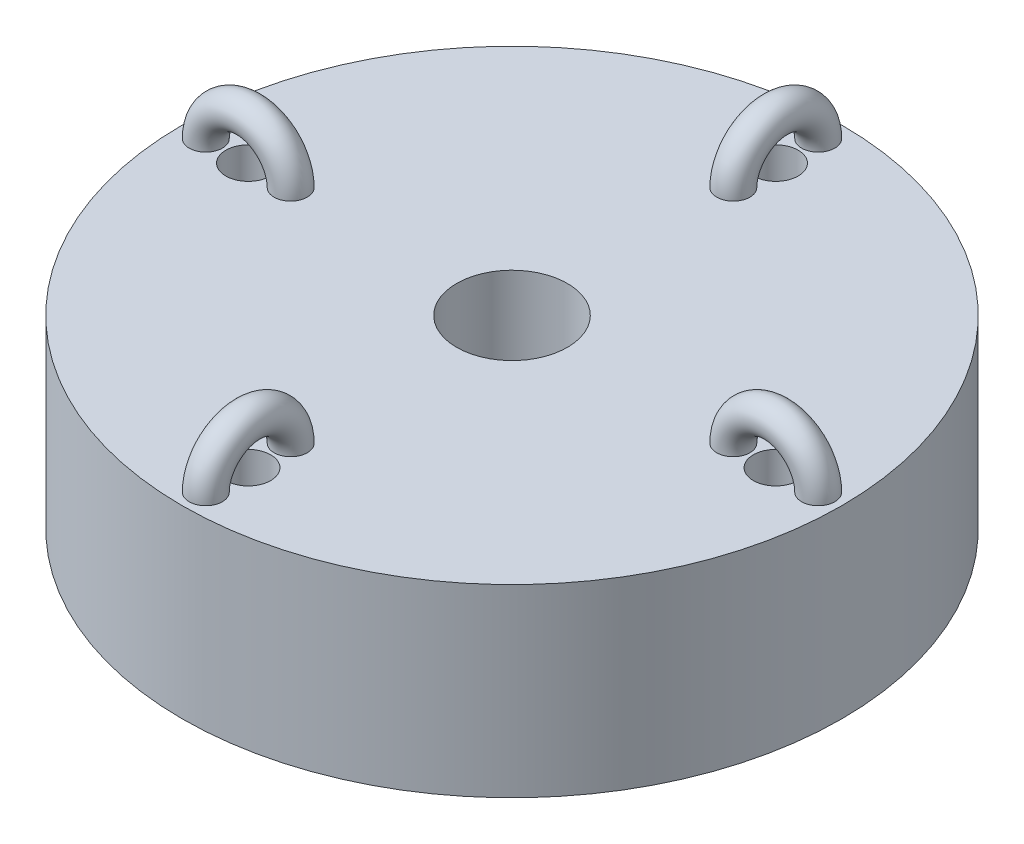
from build123d import *

# Parameters (mm, degrees)
SKETCH_1_R               = 12.5
SKETCH_1_R_2             = 1
SKETCH_1_R_3             = 0.85
EXTRUDE_1_DEPTH          = 7
SKETCH_8_R               = 0.629258673
PATTERN_CIRCULAR_1_COUNT = 4
SKETCH_9_R               = 2.1
CUT_EXTRUDE_3_DEPTH      = 4


with BuildPart() as part:
    # 草图1 → 凸台-拉伸1 (new body)
    with BuildSketch(Plane(origin=(0, 0, 0), x_dir=(1, 0, 0), z_dir=(0, 1, 0))):
        Circle(SKETCH_1_R)
        Circle(SKETCH_1_R_2, mode=Mode.SUBTRACT)
        with Locations((0, 10)):
            Circle(SKETCH_1_R_3, mode=Mode.SUBTRACT)
        with Locations((10, 0)):
            Circle(SKETCH_1_R_3, mode=Mode.SUBTRACT)
        with Locations((0, -10)):
            Circle(SKETCH_1_R_3, mode=Mode.SUBTRACT)
        with Locations((-10, 0)):
            Circle(SKETCH_1_R_3, mode=Mode.SUBTRACT)
    extrude(amount=EXTRUDE_1_DEPTH)

    # 扫描2: sweep along a path in 草图7
    with BuildLine(Plane.XY) as sweep_2_path:
        ThreePointArc((-8.390857018, 7), (-10, 8.609142982), (-11.609142982, 7))
    # 草图8 → 扫描2 (sweep)
    with BuildSketch(Plane(origin=(0, 7, 0), x_dir=(1, 0, 0), z_dir=(0, 1, 0))):
        with Locations((-8.390857018, 0)):
            Circle(SKETCH_8_R)
    sweep_2 = sweep(path=sweep_2_path.line)

    # 阵列(圆周)1: 扫描2 ×4 about axis
    pattern_circular_1_axis = Axis((0, 9.700321738, 0), (0, -1, 0))
    for i in range(1, PATTERN_CIRCULAR_1_COUNT):
        add(sweep_2.rotate(pattern_circular_1_axis, i * 360 / PATTERN_CIRCULAR_1_COUNT))

    # 草图9 → 切除-拉伸3 (cut)
    with BuildSketch(Plane(origin=(0, 7, 0), x_dir=(1, 0, 0), z_dir=(0, 1, 0))):
        Circle(SKETCH_9_R)
    extrude(amount=-CUT_EXTRUDE_3_DEPTH, mode=Mode.SUBTRACT)


solid = part.part
